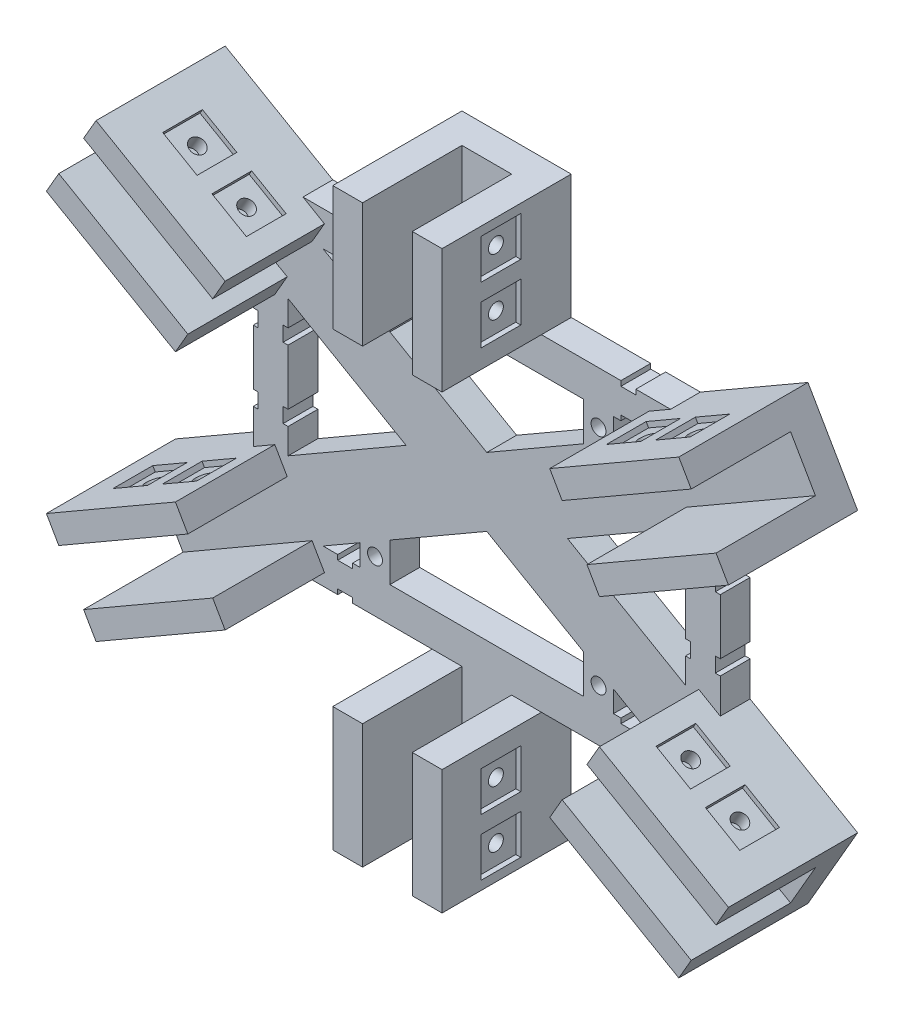
from build123d import *

# Parameters (mm, degrees)
ESQUISSE1_R                = 1.5
BOSS_EXTRU_2_DEPTH         = 6
ENL_V_MAT_EXTRU_2_DEPTH    = 2
ESQUISSE5_W                = 20
ESQUISSE5_H                = 5
BOSS_EXTRU_3_DEPTH         = 30
ESQUISSE7_W                = 20
ESQUISSE7_H                = 5
BOSS_EXTRU_4_DEPTH         = 30
ESQUISSE8_W                = 8
ESQUISSE8_H                = 8
ENL_V_MAT_EXTRU_3_DEPTH    = 1
ESQUISSE9_W                = 8
ESQUISSE9_H                = 8
ENL_V_MAT_EXTRU_4_DEPTH    = 1
ESQUISSE10_R               = 1.5
ENL_V_MAT_EXTRU_5_DEPTH    = 3
SYM_TRIE5_COPY_1_SKETCH_R  = 1.5
SYM_TRIE5_COPY_1_DEPTH     = 3
SYM_TRIE7_COPY_1_SKETCH_R  = 1.5
SYM_TRIE7_COPY_1_DEPTH     = 3
SYM_TRIE7_COPY_2_SKETCH_W  = 8
SYM_TRIE7_COPY_2_SKETCH_H  = 8
SYM_TRIE7_COPY_2_DEPTH     = 1
SYM_TRIE7_COPY_3_SKETCH_W  = 8
SYM_TRIE7_COPY_3_SKETCH_H  = 8
SYM_TRIE7_COPY_3_DEPTH     = 1
SYM_TRIE7_COPY_4_SKETCH_R  = 1.5
SYM_TRIE7_COPY_4_DEPTH     = 3
SYM_TRIE7_COPY_5_SKETCH_R  = 1.5
SYM_TRIE7_COPY_5_DEPTH     = 3
SYM_TRIE8_COPY_1_SKETCH_R  = 1.5
SYM_TRIE8_COPY_1_DEPTH     = 3
SYM_TRIE8_COPY_2_SKETCH_W  = 8
SYM_TRIE8_COPY_2_SKETCH_H  = 8
SYM_TRIE8_COPY_2_DEPTH     = 1
SYM_TRIE8_COPY_3_SKETCH_W  = 8
SYM_TRIE8_COPY_3_SKETCH_H  = 8
SYM_TRIE8_COPY_3_DEPTH     = 1
SYM_TRIE8_COPY_4_SKETCH_R  = 1.5
SYM_TRIE8_COPY_4_DEPTH     = 3
SYM_TRIE8_COPY_5_SKETCH_R  = 1.5
SYM_TRIE8_COPY_5_DEPTH     = 3
SYM_TRIE8_COPY_6_SKETCH_W  = 20
SYM_TRIE8_COPY_6_SKETCH_H  = 5
SYM_TRIE8_COPY_6_DEPTH     = 30
SYM_TRIE8_COPY_7_SKETCH_W  = 20
SYM_TRIE8_COPY_7_SKETCH_H  = 5
SYM_TRIE8_COPY_7_DEPTH     = 30
SYM_TRIE8_COPY_8_SKETCH_W  = 8
SYM_TRIE8_COPY_8_SKETCH_H  = 8
SYM_TRIE8_COPY_8_DEPTH     = 1
SYM_TRIE8_COPY_9_SKETCH_W  = 8
SYM_TRIE8_COPY_9_SKETCH_H  = 8
SYM_TRIE8_COPY_9_DEPTH     = 1
SYM_TRIE8_COPY_10_SKETCH_R = 1.5
SYM_TRIE8_COPY_10_DEPTH    = 3
SYM_TRIE8_COPY_11_SKETCH_R = 1.5
SYM_TRIE8_COPY_11_DEPTH    = 3
SYM_TRIE8_COPY_12_SKETCH_W = 8
SYM_TRIE8_COPY_12_SKETCH_H = 8
SYM_TRIE8_COPY_12_DEPTH    = 1
SYM_TRIE8_COPY_13_SKETCH_W = 8
SYM_TRIE8_COPY_13_SKETCH_H = 8
SYM_TRIE8_COPY_13_DEPTH    = 1
SYM_TRIE8_COPY_14_SKETCH_R = 1.5
SYM_TRIE8_COPY_14_DEPTH    = 3
SYM_TRIE8_COPY_15_SKETCH_R = 1.5
SYM_TRIE8_COPY_15_DEPTH    = 3
ESQUISSE11_W               = 6
ESQUISSE11_H               = 20
BOSS_EXTRU_5_DEPTH         = 25
ESQUISSE50_W               = 8
ESQUISSE50_H               = 8
ENL_V_MAT_EXTRU_25_DEPTH   = 1
ESQUISSE52_W               = 8
ESQUISSE52_H               = 8
ENL_V_MAT_EXTRU_26_DEPTH   = 1
ESQUISSE54_R               = 1.5
ENL_V_MAT_EXTRU_27_DEPTH   = 3
SYM_TRIE10_COPY_1_SKETCH_R = 1.5
SYM_TRIE10_COPY_1_DEPTH    = 3
SYM_TRIE11_COPY_1_SKETCH_R = 1.5
SYM_TRIE11_COPY_1_DEPTH    = 3
SYM_TRIE11_COPY_2_SKETCH_W = 6
SYM_TRIE11_COPY_2_SKETCH_H = 20
SYM_TRIE11_COPY_2_DEPTH    = 25
SYM_TRIE11_COPY_3_SKETCH_W = 8
SYM_TRIE11_COPY_3_SKETCH_H = 8
SYM_TRIE11_COPY_3_DEPTH    = 1
SYM_TRIE11_COPY_4_SKETCH_W = 8
SYM_TRIE11_COPY_4_SKETCH_H = 8
SYM_TRIE11_COPY_4_DEPTH    = 1
SYM_TRIE11_COPY_5_SKETCH_R = 1.5
SYM_TRIE11_COPY_5_DEPTH    = 3
SYM_TRIE11_COPY_6_SKETCH_R = 1.5
SYM_TRIE11_COPY_6_DEPTH    = 3


with BuildPart() as part:
    # Esquisse1 → Boss.-Extru.2 (new body)
    with BuildSketch(Plane.XY):
        Polygon((-27, -32.908965344), (-27, -31.908965344), (-30, -31.908965344), (-30, -32.908965344), (-37, -32.908965344), (-58.650697824, -45.408856694), (-68.650697824, -28.088348618), (-47, -15.588457268), (-47, -8.588457268), (-46, -8.588457268), (-46, -5.588457268), (-47, -5.588457268), (-47, 5.588457268), (-46, 5.588457268), (-46, 8.588457268), (-47, 8.588457268), (-47, 15.588457268), (-68.650697824, 28.088348618), (-58.650697824, 45.408856694), (-37.000062729, 32.908856694), (-30, 32.908965344), (-30, 31.908965344), (-27, 31.908965344), (-27, 32.908965344), (-11, 32.908965344), (-11, 57.908965344), (11, 57.908965344), (11, 32.908965344), (27, 32.908965344), (27, 31.908965344), (30, 31.908965344), (30, 32.908965344), (37.000062729, 32.908856694), (58.650697824, 45.408856694), (68.650697824, 28.088348618), (47, 15.588457268), (47, 8.588457268), (46, 8.588457268), (46, 5.588457268), (47, 5.588457268), (47, -5.588457268), (46, -5.588457268), (46, -8.588457268), (47, -8.588457268), (47, -15.588457268), (68.650697824, -28.088348618), (58.650697824, -45.408856694), (37, -32.908965344), (30, -32.908965344), (30, -31.908965344), (27, -31.908965344), (27, -32.908965344), (11, -32.908965344), (11, -57.908965344), (-11, -57.908965344), (-11, -32.908965344), align=None)
        with Locations((22.5, 22.5)):
            Circle(ESQUISSE1_R, mode=Mode.SUBTRACT)
        with Locations((-22.5, 22.5)):
            Circle(ESQUISSE1_R, mode=Mode.SUBTRACT)
        with Locations((22.5, -22.5)):
            Circle(ESQUISSE1_R, mode=Mode.SUBTRACT)
        with Locations((-22.5, -22.5)):
            Circle(ESQUISSE1_R, mode=Mode.SUBTRACT)
        Polygon((-40, 5.588457268), (-40, -5.588457268), (-41, -5.588457268), (-41, -8.588457268), (-40, -8.588457268), (-40, -13.712812921), (-16.248711306, 0), (-40, 13.712812921), (-40, 8.588457268), (-41, 8.588457268), (-41, 5.588457268), align=None, mode=Mode.SUBTRACT)
        Polygon((40, 13.712812921), (16.248711306, 0), (40, -13.712812921), (40, -8.588457268), (41, -8.588457268), (41, -5.588457268), (40, -5.588457268), (40, 5.588457268), (41, 5.588457268), (41, 8.588457268), (40, 8.588457268), align=None, mode=Mode.SUBTRACT)
        Polygon((-32.958548116, -25.908965344), (-30, -25.908965344), (-30, -26.908965344), (-27, -26.908965344), (-27, -25.908965344), (-25.5, -25.908965344), (-25.5, -21.602770581), align=None, mode=Mode.SUBTRACT)
        Polygon((19.5, -25.908965344), (0, -25.908965344), (-19.5, -25.908965344), (-19.5, -18.138668966), (0, -6.880338717), (19.5, -18.138668966), align=None, mode=Mode.SUBTRACT)
        Polygon((-27, 26.908965344), (-27, 25.908965344), (-25.5, 25.908965344), (-25.5, 21.602770581), (-32.958548116, 25.908965344), (-30, 25.908965344), (-30, 26.908965344), align=None, mode=Mode.SUBTRACT)
        Polygon((32.958548116, 25.908965344), (25.5, 21.602770581), (25.5, 25.908965344), (27, 25.908965344), (27, 26.908965344), (30, 26.908965344), (30, 25.908965344), align=None, mode=Mode.SUBTRACT)
        Polygon((27, -26.908965344), (27, -25.908965344), (25.5, -25.908965344), (25.5, -21.602770581), (32.958548116, -25.908965344), (30, -25.908965344), (30, -26.908965344), align=None, mode=Mode.SUBTRACT)
        Polygon((-19.5, 25.908965344), (-19.5, 18.138668966), (0, 6.880338717), (19.5, 18.138668966), (19.5, 25.908965344), (0, 25.908965344), align=None, mode=Mode.SUBTRACT)
    extrude(amount=BOSS_EXTRU_2_DEPTH)

    # Esquisse4 → Enlèv. mat.-Extru.2 (cut)
    with BuildSketch(Plane(origin=(0, 0, 0), x_dir=(-1, 0, 0), z_dir=(0, 0, -1))):
        Polygon((-22.427668043, 19.687184638), (-20.027864462, 21.156233631), (-20.100196419, 23.969048993), (-22.572331957, 25.312815362), (-24.972135538, 23.843766369), (-24.899803581, 21.030951007), align=None)
        Polygon((24.899803581, 21.030951007), (22.427668043, 19.687184638), (20.027864462, 21.156233631), (20.100196419, 23.969048993), (22.572331957, 25.312815362), (24.972135538, 23.843766369), align=None)
        Polygon((22.427668043, -19.687184638), (20.027864462, -21.156233631), (20.100196419, -23.969048993), (22.572331957, -25.312815362), (24.972135538, -23.843766369), (24.899803581, -21.030951007), align=None)
        Polygon((-24.899803581, -21.030951007), (-22.427668043, -19.687184638), (-20.027864462, -21.156233631), (-20.100196419, -23.969048993), (-22.572331957, -25.312815362), (-24.972135538, -23.843766369), align=None)
    extrude(amount=-ENL_V_MAT_EXTRU_2_DEPTH, mode=Mode.SUBTRACT)

    # Esquisse5 → Boss.-Extru.3 (add)
    with BuildSketch(Plane(origin=(63.650635095, 36.748711306, 0), x_dir=(0, 0, -1), z_dir=(0.8660254037844382, 0.500000000000001, 0))):
        with Locations((-16, -7.500125458)):
            Rectangle(ESQUISSE5_W, ESQUISSE5_H)
    boss_extru_3 = extrude(amount=-BOSS_EXTRU_3_DEPTH)

    # Esquisse7 → Boss.-Extru.4 (add)
    with BuildSketch(Plane(origin=(63.650635095, 36.748711306, 0), x_dir=(0, 0, -1), z_dir=(0.866025403784438, 0.5000000000000009, 0))):
        with Locations((-16, 7.499874542)):
            Rectangle(ESQUISSE7_W, ESQUISSE7_H)
    boss_extru_4 = extrude(amount=-BOSS_EXTRU_4_DEPTH)

    # Esquisse8 → Enlèv. mat.-Extru.3 (cut)
    with BuildSketch(Plane(origin=(5.000062729, -8.660362688, 0), x_dir=(0.8660254037844448, 0.4999999999999891, 0), z_dir=(0.4999999999999892, -0.8660254037844449, 0))):
        with Locations((51.610954886, 14.155470703)):
            Rectangle(ESQUISSE8_W, ESQUISSE8_H)
    enl_v_mat_extru_3 = extrude(amount=-ENL_V_MAT_EXTRU_3_DEPTH, mode=Mode.SUBTRACT)

    # Esquisse9 → Enlèv. mat.-Extru.4 (cut)
    with BuildSketch(Plane(origin=(5.000062729, -8.660362688, 0), x_dir=(0.8660254037844448, 0.4999999999999891, 0), z_dir=(0.4999999999999892, -0.8660254037844449, 0))):
        with Locations((63.062795122, 14.155470703)):
            Rectangle(ESQUISSE9_W, ESQUISSE9_H)
    enl_v_mat_extru_4 = extrude(amount=-ENL_V_MAT_EXTRU_4_DEPTH, mode=Mode.SUBTRACT)

    # Esquisse10 → Enlèv. mat.-Extru.5 (cut)
    with BuildSketch(Plane(origin=(4.500062729, -7.794337284, 0), x_dir=(0.8660254037844448, 0.49999999999998934, 0), z_dir=(0.4999999999999894, -0.8660254037844449, 0))):
        with Locations((51.610954886, 14.155470703)):
            Circle(ESQUISSE10_R)
    enl_v_mat_extru_5 = extrude(amount=-ENL_V_MAT_EXTRU_5_DEPTH, mode=Mode.SUBTRACT)

    # Symétrie4: Enlèv. mat.-Extru.5 across plane
    add(enl_v_mat_extru_5.mirror(Plane(origin=(49.655190327, 28.668437502, 0), x_dir=(0, 0, 1), z_dir=(-0.8660254037844449, -0.4999999999999892, 0))), mode=Mode.SUBTRACT)

    # Symétrie5: Enlèv. mat.-Extru.3, Enlèv. mat.-Extru.4, Enlèv. mat.-Extru.5 across plane
    add(enl_v_mat_extru_3.mirror(Plane(origin=(6.2729e-05, -0.00010865, 0), x_dir=(0, 0, 1), z_dir=(-0.5000000000000009, 0.8660254037844383, 0))), mode=Mode.SUBTRACT)
    add(enl_v_mat_extru_4.mirror(Plane(origin=(6.2729e-05, -0.00010865, 0), x_dir=(0, 0, 1), z_dir=(-0.5000000000000009, 0.8660254037844383, 0))), mode=Mode.SUBTRACT)
    add(enl_v_mat_extru_5.mirror(Plane(origin=(6.2729e-05, -0.00010865, 0), x_dir=(0, 0, 1), z_dir=(-0.5000000000000009, 0.8660254037844383, 0))), mode=Mode.SUBTRACT)

    # Symétrie5 copy 1 sketch → Symétrie5 copy 1 (cut)
    with BuildSketch(Plane(origin=(94.810443383, 65.130994988, 0), x_dir=(-0.8660254037844315, -0.5000000000000128, 1.0015430658247659e-15), z_dir=(-0.500000000000013, 0.8660254037844318, 0))):
        with Locations((51.610954886, 14.155470703)):
            Circle(SYM_TRIE5_COPY_1_SKETCH_R)
    extrude(amount=-SYM_TRIE5_COPY_1_DEPTH, mode=Mode.SUBTRACT)

    # Symétrie7: Boss.-Extru.3, Boss.-Extru.4, Enlèv. mat.-Extru.3, Enlèv. mat.-Extru.4, Enlèv. mat.-Extru.5 across plane
    add(boss_extru_3.mirror(Plane.ZX))
    add(boss_extru_4.mirror(Plane.ZX))
    add(enl_v_mat_extru_3.mirror(Plane.ZX), mode=Mode.SUBTRACT)
    add(enl_v_mat_extru_4.mirror(Plane.ZX), mode=Mode.SUBTRACT)
    add(enl_v_mat_extru_5.mirror(Plane.ZX), mode=Mode.SUBTRACT)

    # Symétrie7 copy 1 sketch → Symétrie7 copy 1 (cut)
    with BuildSketch(Plane(origin=(103.810443383, -49.54253772, 0), x_dir=(-0.866025403784445, 0.49999999999998906, 1.0015430658247659e-15), z_dir=(0.4999999999999891, 0.8660254037844451, 0))):
        with Locations((51.610954886, 14.155470703)):
            Circle(SYM_TRIE7_COPY_1_SKETCH_R)
    extrude(amount=-SYM_TRIE7_COPY_1_DEPTH, mode=Mode.SUBTRACT)

    # Symétrie7 copy 2 sketch → Symétrie7 copy 2 (cut)
    with BuildSketch(Plane(origin=(-4.999937271, -8.660145388, 0), x_dir=(0.8660254037844313, -0.5000000000000124, 0), z_dir=(-0.5000000000000128, -0.8660254037844318, 0))):
        with Locations((51.610954886, 14.155470703)):
            Rectangle(SYM_TRIE7_COPY_2_SKETCH_W, SYM_TRIE7_COPY_2_SKETCH_H)
    extrude(amount=-SYM_TRIE7_COPY_2_DEPTH, mode=Mode.SUBTRACT)

    # Symétrie7 copy 3 sketch → Symétrie7 copy 3 (cut)
    with BuildSketch(Plane(origin=(-4.999937271, -8.660145388, 0), x_dir=(0.8660254037844313, -0.5000000000000124, 0), z_dir=(-0.5000000000000128, -0.8660254037844318, 0))):
        with Locations((63.062795122, 14.155470703)):
            Rectangle(SYM_TRIE7_COPY_3_SKETCH_W, SYM_TRIE7_COPY_3_SKETCH_H)
    extrude(amount=-SYM_TRIE7_COPY_3_DEPTH, mode=Mode.SUBTRACT)

    # Symétrie7 copy 4 sketch → Symétrie7 copy 4 (cut)
    with BuildSketch(Plane(origin=(-4.499937271, -7.794119984, 0), x_dir=(0.8660254037844315, -0.5000000000000123, 0), z_dir=(-0.5000000000000127, -0.866025403784432, 0))):
        with Locations((51.610954886, 14.155470703)):
            Circle(SYM_TRIE7_COPY_4_SKETCH_R)
    extrude(amount=-SYM_TRIE7_COPY_4_DEPTH, mode=Mode.SUBTRACT)

    # Symétrie7 copy 5 sketch → Symétrie7 copy 5 (cut)
    with BuildSketch(Plane(origin=(94.810443383, -65.130994988, 0), x_dir=(-0.8660254037844315, 0.5000000000000128, 1.0015430658247659e-15), z_dir=(-0.500000000000013, -0.8660254037844318, 0))):
        with Locations((51.610954886, -14.155470703)):
            Circle(SYM_TRIE7_COPY_5_SKETCH_R)
    extrude(amount=-SYM_TRIE7_COPY_5_DEPTH, mode=Mode.SUBTRACT)

    # Symétrie8: Boss.-Extru.3, Boss.-Extru.4, Enlèv. mat.-Extru.3, Enlèv. mat.-Extru.4, Enlèv. mat.-Extru.5 across plane
    add(boss_extru_3.mirror(Plane(origin=(0, 0, 0), x_dir=(0, 0, 1), z_dir=(1, 0, 0))))
    add(boss_extru_4.mirror(Plane(origin=(0, 0, 0), x_dir=(0, 0, 1), z_dir=(1, 0, 0))))
    add(enl_v_mat_extru_3.mirror(Plane(origin=(0, 0, 0), x_dir=(0, 0, 1), z_dir=(1, 0, 0))), mode=Mode.SUBTRACT)
    add(enl_v_mat_extru_4.mirror(Plane(origin=(0, 0, 0), x_dir=(0, 0, 1), z_dir=(1, 0, 0))), mode=Mode.SUBTRACT)
    add(enl_v_mat_extru_5.mirror(Plane(origin=(0, 0, 0), x_dir=(0, 0, 1), z_dir=(1, 0, 0))), mode=Mode.SUBTRACT)

    # Symétrie8 copy 1 sketch → Symétrie8 copy 1 (cut)
    with BuildSketch(Plane(origin=(-103.810443383, 49.54253772, 0), x_dir=(0.866025403784445, -0.49999999999998906, 1.0015430658247659e-15), z_dir=(-0.4999999999999891, -0.8660254037844451, 0))):
        with Locations((51.610954886, 14.155470703)):
            Circle(SYM_TRIE8_COPY_1_SKETCH_R)
    extrude(amount=-SYM_TRIE8_COPY_1_DEPTH, mode=Mode.SUBTRACT)

    # Symétrie8 copy 2 sketch → Symétrie8 copy 2 (cut)
    with BuildSketch(Plane(origin=(4.999937271, 8.660145388, 0), x_dir=(-0.8660254037844313, 0.5000000000000124, 0), z_dir=(0.5000000000000128, 0.8660254037844318, 0))):
        with Locations((51.610954886, 14.155470703)):
            Rectangle(SYM_TRIE8_COPY_2_SKETCH_W, SYM_TRIE8_COPY_2_SKETCH_H)
    extrude(amount=-SYM_TRIE8_COPY_2_DEPTH, mode=Mode.SUBTRACT)

    # Symétrie8 copy 3 sketch → Symétrie8 copy 3 (cut)
    with BuildSketch(Plane(origin=(4.999937271, 8.660145388, 0), x_dir=(-0.8660254037844313, 0.5000000000000124, 0), z_dir=(0.5000000000000128, 0.8660254037844318, 0))):
        with Locations((63.062795122, 14.155470703)):
            Rectangle(SYM_TRIE8_COPY_3_SKETCH_W, SYM_TRIE8_COPY_3_SKETCH_H)
    extrude(amount=-SYM_TRIE8_COPY_3_DEPTH, mode=Mode.SUBTRACT)

    # Symétrie8 copy 4 sketch → Symétrie8 copy 4 (cut)
    with BuildSketch(Plane(origin=(4.499937271, 7.794119984, 0), x_dir=(-0.8660254037844315, 0.5000000000000123, 0), z_dir=(0.5000000000000127, 0.866025403784432, 0))):
        with Locations((51.610954886, 14.155470703)):
            Circle(SYM_TRIE8_COPY_4_SKETCH_R)
    extrude(amount=-SYM_TRIE8_COPY_4_DEPTH, mode=Mode.SUBTRACT)

    # Symétrie8 copy 5 sketch → Symétrie8 copy 5 (cut)
    with BuildSketch(Plane(origin=(-94.810443383, 65.130994988, 0), x_dir=(0.8660254037844315, -0.5000000000000128, 1.0015430658247659e-15), z_dir=(0.500000000000013, 0.8660254037844318, 0))):
        with Locations((51.610954886, -14.155470703)):
            Circle(SYM_TRIE8_COPY_5_SKETCH_R)
    extrude(amount=-SYM_TRIE8_COPY_5_DEPTH, mode=Mode.SUBTRACT)

    # Symétrie8 copy 6 sketch → Symétrie8 copy 6 (add)
    with BuildSketch(Plane(origin=(-63.650635095, -36.748711306, 0), x_dir=(0, 0, -1), z_dir=(-0.8660254037844382, -0.500000000000001, 0))):
        with Locations((-16, -7.500125458)):
            Rectangle(SYM_TRIE8_COPY_6_SKETCH_W, SYM_TRIE8_COPY_6_SKETCH_H)
    extrude(amount=-SYM_TRIE8_COPY_6_DEPTH)

    # Symétrie8 copy 7 sketch → Symétrie8 copy 7 (add)
    with BuildSketch(Plane(origin=(-63.650635095, -36.748711306, 0), x_dir=(0, 0, -1), z_dir=(-0.866025403784438, -0.5000000000000009, 0))):
        with Locations((-16, 7.499874542)):
            Rectangle(SYM_TRIE8_COPY_7_SKETCH_W, SYM_TRIE8_COPY_7_SKETCH_H)
    extrude(amount=-SYM_TRIE8_COPY_7_DEPTH)

    # Symétrie8 copy 8 sketch → Symétrie8 copy 8 (cut)
    with BuildSketch(Plane(origin=(-5.000062729, 8.660362688, 0), x_dir=(-0.8660254037844448, -0.4999999999999891, 0), z_dir=(-0.4999999999999892, 0.8660254037844449, 0))):
        with Locations((51.610954886, 14.155470703)):
            Rectangle(SYM_TRIE8_COPY_8_SKETCH_W, SYM_TRIE8_COPY_8_SKETCH_H)
    extrude(amount=-SYM_TRIE8_COPY_8_DEPTH, mode=Mode.SUBTRACT)

    # Symétrie8 copy 9 sketch → Symétrie8 copy 9 (cut)
    with BuildSketch(Plane(origin=(-5.000062729, 8.660362688, 0), x_dir=(-0.8660254037844448, -0.4999999999999891, 0), z_dir=(-0.4999999999999892, 0.8660254037844449, 0))):
        with Locations((63.062795122, 14.155470703)):
            Rectangle(SYM_TRIE8_COPY_9_SKETCH_W, SYM_TRIE8_COPY_9_SKETCH_H)
    extrude(amount=-SYM_TRIE8_COPY_9_DEPTH, mode=Mode.SUBTRACT)

    # Symétrie8 copy 10 sketch → Symétrie8 copy 10 (cut)
    with BuildSketch(Plane(origin=(-4.500062729, 7.794337284, 0), x_dir=(-0.8660254037844448, -0.49999999999998934, 0), z_dir=(-0.4999999999999894, 0.8660254037844449, 0))):
        with Locations((51.610954886, 14.155470703)):
            Circle(SYM_TRIE8_COPY_10_SKETCH_R)
    extrude(amount=-SYM_TRIE8_COPY_10_DEPTH, mode=Mode.SUBTRACT)

    # Symétrie8 copy 11 sketch → Symétrie8 copy 11 (cut)
    with BuildSketch(Plane(origin=(-103.810443383, -49.54253772, 0), x_dir=(0.866025403784445, 0.49999999999998906, 1.0015430658247659e-15), z_dir=(-0.4999999999999891, 0.8660254037844451, 0))):
        with Locations((51.610954886, -14.155470703)):
            Circle(SYM_TRIE8_COPY_11_SKETCH_R)
    extrude(amount=-SYM_TRIE8_COPY_11_DEPTH, mode=Mode.SUBTRACT)

    # Symétrie8 copy 12 sketch → Symétrie8 copy 12 (cut)
    with BuildSketch(Plane(origin=(4.999937271, -8.660145388, 0), x_dir=(-0.8660254037844313, -0.5000000000000124, 0), z_dir=(0.5000000000000128, -0.8660254037844318, 0))):
        with Locations((51.610954886, -14.155470703)):
            Rectangle(SYM_TRIE8_COPY_12_SKETCH_W, SYM_TRIE8_COPY_12_SKETCH_H)
    extrude(amount=-SYM_TRIE8_COPY_12_DEPTH, mode=Mode.SUBTRACT)

    # Symétrie8 copy 13 sketch → Symétrie8 copy 13 (cut)
    with BuildSketch(Plane(origin=(4.999937271, -8.660145388, 0), x_dir=(-0.8660254037844313, -0.5000000000000124, 0), z_dir=(0.5000000000000128, -0.8660254037844318, 0))):
        with Locations((63.062795122, -14.155470703)):
            Rectangle(SYM_TRIE8_COPY_13_SKETCH_W, SYM_TRIE8_COPY_13_SKETCH_H)
    extrude(amount=-SYM_TRIE8_COPY_13_DEPTH, mode=Mode.SUBTRACT)

    # Symétrie8 copy 14 sketch → Symétrie8 copy 14 (cut)
    with BuildSketch(Plane(origin=(4.499937271, -7.794119984, 0), x_dir=(-0.8660254037844315, -0.5000000000000123, 0), z_dir=(0.5000000000000127, -0.866025403784432, 0))):
        with Locations((51.610954886, -14.155470703)):
            Circle(SYM_TRIE8_COPY_14_SKETCH_R)
    extrude(amount=-SYM_TRIE8_COPY_14_DEPTH, mode=Mode.SUBTRACT)

    # Symétrie8 copy 15 sketch → Symétrie8 copy 15 (cut)
    with BuildSketch(Plane(origin=(-94.810443383, -65.130994988, 0), x_dir=(0.8660254037844315, 0.5000000000000128, 1.0015430658247659e-15), z_dir=(0.500000000000013, -0.8660254037844318, 0))):
        with Locations((51.610954886, 14.155470703)):
            Circle(SYM_TRIE8_COPY_15_SKETCH_R)
    extrude(amount=-SYM_TRIE8_COPY_15_DEPTH, mode=Mode.SUBTRACT)

    # Esquisse11 → Boss.-Extru.5 (add)
    with BuildSketch(Plane(origin=(0, 57.908965344, 0), x_dir=(1, 0, 0), z_dir=(0, 1, 0))):
        with Locations((-8, -16)):
            Rectangle(ESQUISSE11_W, ESQUISSE11_H)
    boss_extru_5 = extrude(amount=-BOSS_EXTRU_5_DEPTH)

    # Esquisse50 → Enlèv. mat.-Extru.25 (cut)
    with BuildSketch(Plane(origin=(-11, 26.517737728, -42.965253421), x_dir=(0, 0, 1), z_dir=(-1, 0, 0))):
        with Locations((57.125253421, 14.155470703)):
            Rectangle(ESQUISSE50_W, ESQUISSE50_H)
    enl_v_mat_extru_25 = extrude(amount=-ENL_V_MAT_EXTRU_25_DEPTH, mode=Mode.SUBTRACT)

    # Esquisse52 → Enlèv. mat.-Extru.26 (cut)
    with BuildSketch(Plane(origin=(-11, 26.517737728, -42.965253421), x_dir=(0, 0, 1), z_dir=(-1, 0, 0))):
        with Locations((57.125253421, 25.605470703)):
            Rectangle(ESQUISSE52_W, ESQUISSE52_H)
    enl_v_mat_extru_26 = extrude(amount=-ENL_V_MAT_EXTRU_26_DEPTH, mode=Mode.SUBTRACT)

    # Esquisse54 → Enlèv. mat.-Extru.27 (cut)
    with BuildSketch(Plane(origin=(-10, 26.517737728, -42.965253421), x_dir=(0, 0, 1), z_dir=(-1, 0, 0))):
        with Locations(Location((57.125253421, 14.155470703, 0), (0, 0, 270))):
            Circle(ESQUISSE54_R)
    enl_v_mat_extru_27 = extrude(amount=-ENL_V_MAT_EXTRU_27_DEPTH, mode=Mode.SUBTRACT)

    # Symétrie9: Enlèv. mat.-Extru.27 across plane
    add(enl_v_mat_extru_27.mirror(Plane.ZX.offset(46.398208431)), mode=Mode.SUBTRACT)

    # Symétrie10: Boss.-Extru.5, Enlèv. mat.-Extru.25, Enlèv. mat.-Extru.26, Enlèv. mat.-Extru.27 across plane
    add(boss_extru_5.mirror(Plane.ZY))
    add(enl_v_mat_extru_25.mirror(Plane.ZY), mode=Mode.SUBTRACT)
    add(enl_v_mat_extru_26.mirror(Plane.ZY), mode=Mode.SUBTRACT)
    add(enl_v_mat_extru_27.mirror(Plane.ZY), mode=Mode.SUBTRACT)

    # Symétrie10 copy 1 sketch → Symétrie10 copy 1 (cut)
    with BuildSketch(Plane(origin=(10, 66.278679134, -42.965253421), x_dir=(0, 0, 1), z_dir=(1, 0, 0))):
        with Locations(Location((57.125253421, 14.155470703, 0), (0, 0, 270))):
            Circle(SYM_TRIE10_COPY_1_SKETCH_R)
    extrude(amount=-SYM_TRIE10_COPY_1_DEPTH, mode=Mode.SUBTRACT)

    # Symétrie11: Boss.-Extru.5, Enlèv. mat.-Extru.25, Enlèv. mat.-Extru.26, Enlèv. mat.-Extru.27 across plane
    add(boss_extru_5.mirror(Plane.ZX))
    add(enl_v_mat_extru_25.mirror(Plane.ZX), mode=Mode.SUBTRACT)
    add(enl_v_mat_extru_26.mirror(Plane.ZX), mode=Mode.SUBTRACT)
    add(enl_v_mat_extru_27.mirror(Plane.ZX), mode=Mode.SUBTRACT)

    # Symétrie11 copy 1 sketch → Symétrie11 copy 1 (cut)
    with BuildSketch(Plane(origin=(-10, -66.278679134, -42.965253421), x_dir=(0, 0, 1), z_dir=(-1, 0, 0))):
        with Locations(Location((57.125253421, 14.155470703, 0), (0, 0, 270))):
            Circle(SYM_TRIE11_COPY_1_SKETCH_R)
    extrude(amount=-SYM_TRIE11_COPY_1_DEPTH, mode=Mode.SUBTRACT)

    # Symétrie11 copy 2 sketch → Symétrie11 copy 2 (add)
    with BuildSketch(Plane(origin=(0, -57.908965344, 0), x_dir=(-1, 0, 0), z_dir=(0, -1, 0))):
        with Locations((-8, -16)):
            Rectangle(SYM_TRIE11_COPY_2_SKETCH_W, SYM_TRIE11_COPY_2_SKETCH_H)
    extrude(amount=-SYM_TRIE11_COPY_2_DEPTH)

    # Symétrie11 copy 3 sketch → Symétrie11 copy 3 (cut)
    with BuildSketch(Plane(origin=(11, -26.517737728, -42.965253421), x_dir=(0, 0, 1), z_dir=(1, 0, 0))):
        with Locations((57.125253421, 14.155470703)):
            Rectangle(SYM_TRIE11_COPY_3_SKETCH_W, SYM_TRIE11_COPY_3_SKETCH_H)
    extrude(amount=-SYM_TRIE11_COPY_3_DEPTH, mode=Mode.SUBTRACT)

    # Symétrie11 copy 4 sketch → Symétrie11 copy 4 (cut)
    with BuildSketch(Plane(origin=(11, -26.517737728, -42.965253421), x_dir=(0, 0, 1), z_dir=(1, 0, 0))):
        with Locations((57.125253421, 25.605470703)):
            Rectangle(SYM_TRIE11_COPY_4_SKETCH_W, SYM_TRIE11_COPY_4_SKETCH_H)
    extrude(amount=-SYM_TRIE11_COPY_4_DEPTH, mode=Mode.SUBTRACT)

    # Symétrie11 copy 5 sketch → Symétrie11 copy 5 (cut)
    with BuildSketch(Plane(origin=(10, -26.517737728, -42.965253421), x_dir=(0, 0, 1), z_dir=(1, 0, 0))):
        with Locations(Location((57.125253421, 14.155470703, 0), (0, 0, 270))):
            Circle(SYM_TRIE11_COPY_5_SKETCH_R)
    extrude(amount=-SYM_TRIE11_COPY_5_DEPTH, mode=Mode.SUBTRACT)

    # Symétrie11 copy 6 sketch → Symétrie11 copy 6 (cut)
    with BuildSketch(Plane(origin=(10, -66.278679134, -42.965253421), x_dir=(0, 0, 1), z_dir=(1, 0, 0))):
        with Locations((57.125253421, -14.155470703)):
            Circle(SYM_TRIE11_COPY_6_SKETCH_R)
    extrude(amount=-SYM_TRIE11_COPY_6_DEPTH, mode=Mode.SUBTRACT)


solid = part.part
